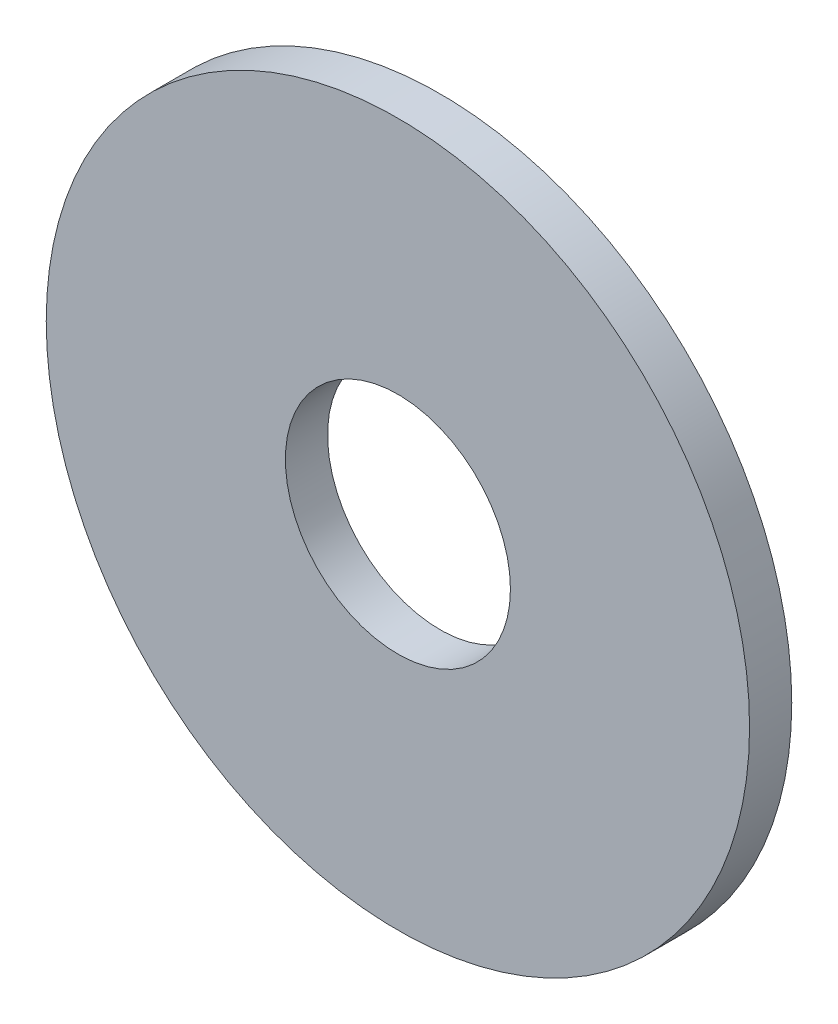
from build123d import *

# Parameters (mm, degrees)
SKETCH1_R      = 12.5
SKETCH1_R_2    = 4
EXTRUDE1_DEPTH = 1.5


with BuildPart() as part:
    # Sketch1 → Extrude1 (new body)
    with BuildSketch(Plane.XY):
        Circle(SKETCH1_R)
        Circle(SKETCH1_R_2, mode=Mode.SUBTRACT)
    extrude(amount=EXTRUDE1_DEPTH)


solid = part.part
